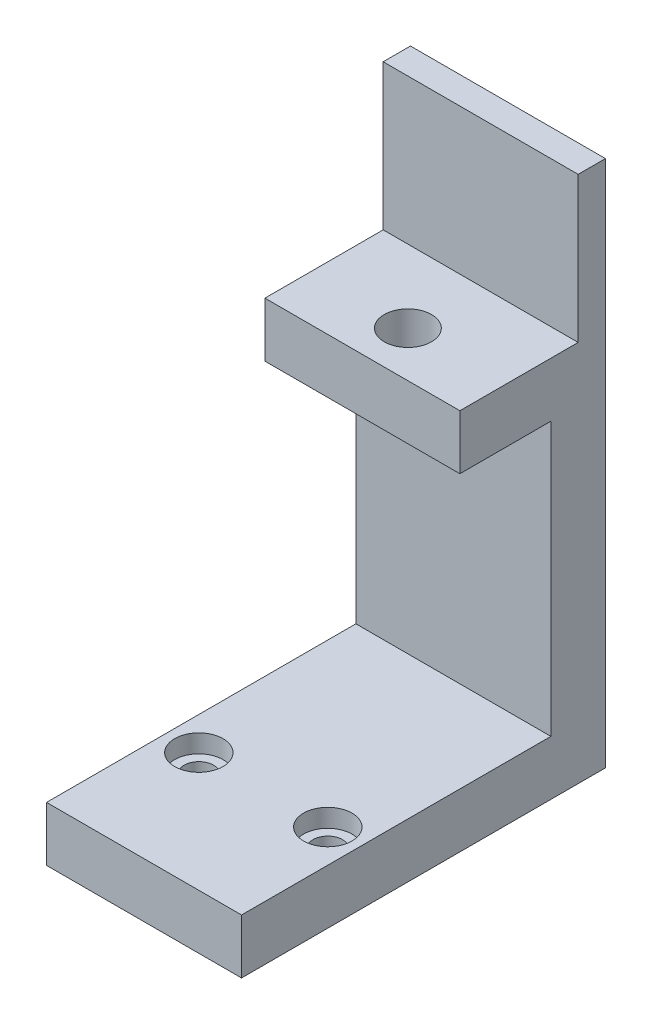
from build123d import *

# Parameters (mm, degrees)
SKETCH1_W           = 27.22
SKETCH1_H           = 50.8
BOSS_EXTRUDE1_DEPTH = 7.62
SKETCH2_R           = 2.05
CUT_EXTRUDE1_DEPTH  = 7.62
SKETCH3_R           = 3.3782
CUT_EXTRUDE2_DEPTH  = 2.54
SKETCH4_W           = 27.22
SKETCH4_H           = 7.62
BOSS_EXTRUDE2_DEPTH = 45.72
SKETCH10_W          = 27.22
SKETCH10_H          = 7.62
BOSS_EXTRUDE3_DEPTH = 12.7
CUT_EXTRUDE6_DEPTH  = 7.62
SKETCH13_R          = 4.826
CUT_EXTRUDE7_DEPTH  = 2.54
SKETCH12_W          = 27.22
SKETCH12_H          = 3.81
BOSS_EXTRUDE4_DEPTH = 20.32


with BuildPart() as part:
    # Sketch1 → Boss-Extrude1 (new body)
    with BuildSketch(Plane(origin=(0, 0, 0), x_dir=(1, 0, 0), z_dir=(0, 1, 0))):
        with Locations((-0.346834532, 16.982733813)):
            Rectangle(SKETCH1_W, SKETCH1_H)
    extrude(amount=BOSS_EXTRUDE1_DEPTH)

    # Sketch2 → Cut-Extrude1 (cut)
    with BuildSketch(Plane(origin=(0, 7.62, 0), x_dir=(1, 0, 0), z_dir=(0, 1, 0))):
        with Locations(Location((-9.346834532, 8.232733813, 0), (0, 0, 270))):
            Circle(SKETCH2_R)
    cut_extrude1 = extrude(amount=-CUT_EXTRUDE1_DEPTH, mode=Mode.SUBTRACT)

    # Sketch3 → Cut-Extrude2 (cut)
    with BuildSketch(Plane(origin=(0, 7.62, 0), x_dir=(1, 0, 0), z_dir=(0, 1, 0))):
        with Locations(Location((-9.346834532, 8.232733813, 0), (0, 0, 270))):
            Circle(SKETCH3_R)
    cut_extrude2 = extrude(amount=-CUT_EXTRUDE2_DEPTH, mode=Mode.SUBTRACT)

    # Mirror1: Cut-Extrude1, Cut-Extrude2 across plane
    add(cut_extrude1.mirror(Plane.ZY.offset(0.346834532)), mode=Mode.SUBTRACT)
    add(cut_extrude2.mirror(Plane.ZY.offset(0.346834532)), mode=Mode.SUBTRACT)

    # Sketch4 → Boss-Extrude2 (add)
    with BuildSketch(Plane(origin=(0, 7.62, 0), x_dir=(1, 0, 0), z_dir=(0, 1, 0))):
        with Locations((-0.346834532, 38.572733813)):
            Rectangle(SKETCH4_W, SKETCH4_H)
    extrude(amount=BOSS_EXTRUDE2_DEPTH)

    # Sketch10 → Boss-Extrude3 (add)
    with BuildSketch(Plane.XY.offset(-34.762733813)):
        with Locations((-0.346834532, 49.53)):
            Rectangle(SKETCH10_W, SKETCH10_H)
    extrude(amount=BOSS_EXTRUDE3_DEPTH)

    # Sketch11 → Cut-Extrude6 (cut)
    with BuildSketch(Plane.XZ.offset(-45.72)):
        with BuildLine():
            ThreePointArc((2.955165468, -28.412733813), (1.988032059, -26.077867221), (-0.346834532, -25.110733813))
            Line((-0.346834532, -25.110733813), (-0.346834532, -31.714733813))
            ThreePointArc((-0.346834532, -31.714733813), (1.988032059, -30.747600404), (2.955165468, -28.412733813))
        make_face()
        with BuildLine():
            Line((-0.346834532, -31.714733813), (-0.346834532, -25.110733813))
            ThreePointArc((-0.346834532, -25.110733813), (-3.648834532, -28.412733813), (-0.346834532, -31.714733813))
        make_face()
    extrude(amount=-CUT_EXTRUDE6_DEPTH, mode=Mode.SUBTRACT)

    # Sketch13 → Cut-Extrude7 (cut)
    with BuildSketch(Plane.XZ.offset(-45.72)):
        with Locations(Location((-0.346834532, -28.412733813, 0), (0, 0, 270))):
            Circle(SKETCH13_R)
    extrude(amount=-CUT_EXTRUDE7_DEPTH, mode=Mode.SUBTRACT)

    # Sketch12 → Boss-Extrude4 (add)
    with BuildSketch(Plane(origin=(0, 53.34, 0), x_dir=(1, 0, 0), z_dir=(0, 1, 0))):
        with Locations((-0.346834532, 40.477733813)):
            Rectangle(SKETCH12_W, SKETCH12_H)
    extrude(amount=BOSS_EXTRUDE4_DEPTH)


solid = part.part
